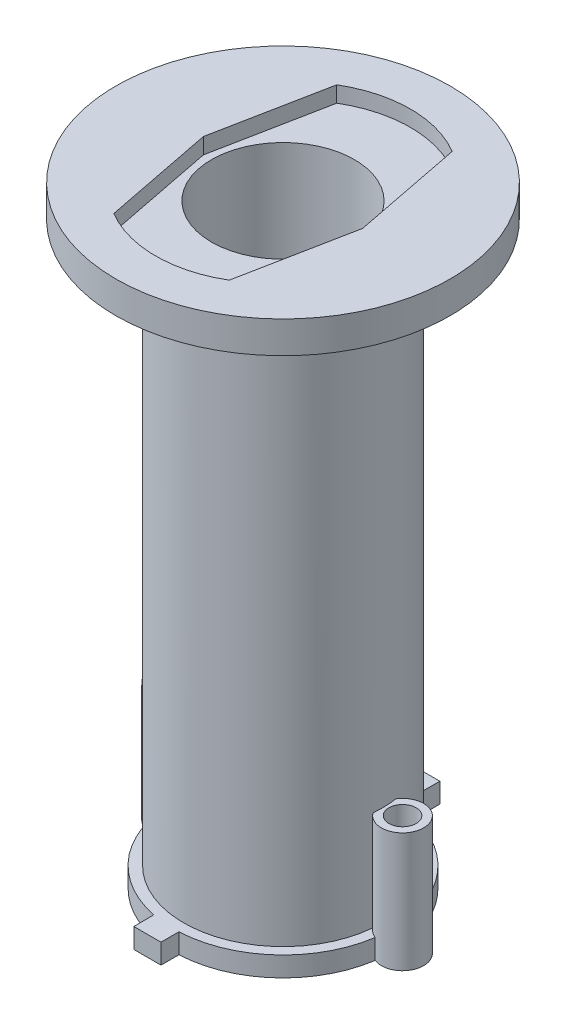
from build123d import *

# Parameters (mm, degrees)
BOSS_EXTRUDE1_DEPTH = 2.5
CUT_EXTRUDE1_REACH  = 26.645
SKETCH2_R           = 1.715
SKETCH2_R_2         = 8.98
SKETCH3_R           = 2.6543
BOSS_EXTRUDE2_DEPTH = 70.305
BOSS_EXTRUDE3_START = 4
SKETCH4_R           = 21
SKETCH4_R_2         = 8.98
BOSS_EXTRUDE3_DEPTH = 4
SKETCH6_R           = 21
SKETCH6_R_2         = 8.98
BOSS_EXTRUDE4_DEPTH = 2
CUT_EXTRUDE3_START  = -15
SKETCH7_R           = 1.715
CUT_EXTRUDE3_DEPTH  = 15
SKETCH8_R           = 8.98
CUT_EXTRUDE4_DEPTH  = 2
BOSS_EXTRUDE6_REACH = 82.451
SKETCH10_R          = 12.48
SKETCH10_R_2        = 8.98
SKETCH12_R          = 21
SKETCH12_R_2        = 12.48
CUT_EXTRUDE5_DEPTH  = 57.805


with BuildPart() as part:
    # Sketch1 → Boss-Extrude1 (new body)
    with BuildSketch(Plane(origin=(0, 0, 0), x_dir=(1, 0, 0), z_dir=(0, 1, 0))):
        with BuildLine():
            Line((0.597960958, 12.236443242), (0.597960958, 17.5133))
            Line((0.597960958, 17.5133), (-2.819411684, 17.5133))
            Line((-2.819411684, 17.5133), (-2.819411684, 11.976881697))
            ThreePointArc((-2.819411684, 11.976881697), (-9.752212861, 8.278991937), (-13.533031252, 1.391065316))
            ThreePointArc((-13.533031252, 1.391065316), (-17.156497956, -0.999626805), (-13.683409812, -3.603965207))
            ThreePointArc((-13.683409812, -3.603965207), (-10.042516815, -11.01106651), (-2.819411684, -15.004561697))
            Line((-2.819411684, -15.004561697), (-2.819411684, -17.5133))
            Line((-2.819411684, -17.5133), (0.597960958, -17.5133))
            Line((0.597960958, -17.5133), (0.597960958, -15.264123242))
            ThreePointArc((0.597960958, -15.264123242), (9.161591247, -11.721092084), (13.538839655, -3.55233882))
            ThreePointArc((13.538839655, -3.55233882), (17.156522938, -1.000460972), (13.393344487, 1.331534062))
            ThreePointArc((13.393344487, 1.331534062), (8.853545908, 8.96396608), (0.597960958, 12.236443242))
        make_face()
    extrude(amount=BOSS_EXTRUDE1_DEPTH)

    # Sketch2 → Cut-Extrude1 (cut, up to next)
    with BuildSketch(Plane(origin=(0, 2.5, 0), x_dir=(1, 0, 0), z_dir=(0, 1, 0)), mode=Mode.PRIVATE) as cut_extrude1_sk1:
        with Locations(Location((-14.5034, -1.0795, 0), (0, 0, 270))):
            Circle(SKETCH2_R)
    cut_extrude1_tool1 = extrude(cut_extrude1_sk1.sketch, amount=-CUT_EXTRUDE1_REACH, mode=Mode.PRIVATE) & part.part
    # Sketch2 → Cut-Extrude1 (cut, up to next)
    with BuildSketch(Plane(origin=(0, 2.5, 0), x_dir=(1, 0, 0), z_dir=(0, 1, 0)), mode=Mode.PRIVATE) as cut_extrude1_sk2:
        with Locations(Location((14.5034, -1.0795, 0), (0, 0, 270))):
            Circle(SKETCH2_R)
    cut_extrude1_tool2 = extrude(cut_extrude1_sk2.sketch, amount=-CUT_EXTRUDE1_REACH, mode=Mode.PRIVATE) & part.part
    # Sketch2 → Cut-Extrude1 (cut, up to next)
    with BuildSketch(Plane(origin=(0, 2.5, 0), x_dir=(1, 0, 0), z_dir=(0, 1, 0)), mode=Mode.PRIVATE) as cut_extrude1_sk3:
        with Locations(Location((-0.0762, -1.51384, 0), (0, 0, 270))):
            Circle(SKETCH2_R_2)
    cut_extrude1_tool3 = extrude(cut_extrude1_sk3.sketch, amount=-CUT_EXTRUDE1_REACH, mode=Mode.PRIVATE) & part.part
    add(cut_extrude1_tool1.solids().sort_by_distance((-14.5034, 2.5, 1.0795))[0], mode=Mode.SUBTRACT)
    add(cut_extrude1_tool2.solids().sort_by_distance((14.5034, 2.5, 1.0795))[0], mode=Mode.SUBTRACT)
    add(cut_extrude1_tool3.solids().sort_by_distance((-0.0762, 2.5, 1.51384))[0], mode=Mode.SUBTRACT)

    # Sketch3 → Boss-Extrude2 (add)
    with BuildSketch(Plane(origin=(0, 2.5, 0), x_dir=(1, 0, 0), z_dir=(0, 1, 0))):
        with Locations(Location((-14.5034, -1.0795, 0), (0, 0, 68.556492541))):
            Circle(SKETCH3_R)
        with Locations(Location((14.5034, -1.0795, 0), (0, 0, 114.72164566))):
            Circle(SKETCH3_R)
    extrude(amount=BOSS_EXTRUDE2_DEPTH)

    # Sketch4 → Boss-Extrude3 (add)
    with BuildSketch(Plane(origin=(0, 72.805, 0), x_dir=(1, 0, 0), z_dir=(0, 1, 0)).offset(BOSS_EXTRUDE3_START)):
        with Locations(Location((-0.0762, -1.51384, 0), (0, 0, 270))):
            Circle(SKETCH4_R)
        with Locations(Location((-0.0762, -1.51384, 0), (0, 0, 270))):
            Circle(SKETCH4_R_2, mode=Mode.SUBTRACT)
    extrude(amount=-BOSS_EXTRUDE3_DEPTH)

    # Sketch6 → Boss-Extrude4 (add)
    with BuildSketch(Plane(origin=(0, 37.805, 0), x_dir=(-1, 0, 0), z_dir=(0, -1, 0))):
        with Locations(Location((0.0762, -1.51384, 0), (0, 0, 90))):
            Circle(SKETCH6_R)
        with Locations(Location((0.0762, -1.51384, 0), (0, 0, 270))):
            Circle(SKETCH6_R_2, mode=Mode.SUBTRACT)
    extrude(amount=BOSS_EXTRUDE4_DEPTH)

    # Sketch7 → Cut-Extrude3 (cut)
    with BuildSketch(Plane.XZ.offset(CUT_EXTRUDE3_START)):
        with Locations(Location((-14.5034, 1.0795, 0), (0, 0, 90))):
            Circle(SKETCH7_R)
        with Locations(Location((14.5034, 1.0795, 0), (0, 0, 90))):
            Circle(SKETCH7_R)
    extrude(amount=CUT_EXTRUDE3_DEPTH, mode=Mode.SUBTRACT)

    # Sketch8 → Cut-Extrude4 (cut)
    with BuildSketch(Plane(origin=(0, 76.805, 0), x_dir=(1, 0, 0), z_dir=(0, 1, 0))):
        with BuildLine():
            Line((-10.0762, -1.51384), (-7.3262, -15.51384))
            ThreePointArc((-7.3262, -15.51384), (-0.0762, -17.51384), (7.1738, -15.51384))
            Line((7.1738, -15.51384), (9.9238, -1.51384))
            Line((9.9238, -1.51384), (7.1738, 12.48616))
            ThreePointArc((7.1738, 12.48616), (-0.0762, 14.48616), (-7.3262, 12.48616))
            Line((-7.3262, 12.48616), (-10.0762, -1.51384))
        make_face()
        with Locations(Location((-0.0762, -1.51384, 0), (0, 0, 270))):
            Circle(SKETCH8_R, mode=Mode.SUBTRACT)
    extrude(amount=-CUT_EXTRUDE4_DEPTH, mode=Mode.SUBTRACT)

    # Boss-Extrude6: up to this face of the body (flat: up to its plane)
    boss_extrude6_end = Plane(part.part.faces().sort_by_distance((-0.0762, 72.805, -18.892190304))[0])
    # Sketch10 → Boss-Extrude6 (add, up to the picked face)
    with BuildSketch(Plane(origin=(0, 2.5, 0), x_dir=(1, 0, 0), z_dir=(0, 1, 0)), mode=Mode.PRIVATE) as boss_extrude6_sk1:
        with Locations((-0.0762, -1.51384)):
            Circle(SKETCH10_R)
        with Locations(Location((-0.0762, -1.51384, 0), (0, 0, 270))):
            Circle(SKETCH10_R_2, mode=Mode.SUBTRACT)
    boss_extrude6_tool1 = split(extrude(boss_extrude6_sk1.sketch, amount=BOSS_EXTRUDE6_REACH, mode=Mode.PRIVATE), bisect_by=boss_extrude6_end, keep=Keep.BOTH, mode=Mode.PRIVATE)
    add(boss_extrude6_tool1.solids().sort_by(Axis((-12.203212, 2.5, 1.51384), (0, 1, 0)))[0])

    # Sketch12 → Cut-Extrude5 (cut)
    with BuildSketch(Plane.XZ.offset(-15)):
        with Locations(Location((-0.0762, 1.51384, 0), (0, 0, 90))):
            Circle(SKETCH12_R)
        with Locations(Location((-0.0762, 1.51384, 0), (0, 0, 189.400360909))):
            Circle(SKETCH12_R_2, mode=Mode.SUBTRACT)
    extrude(amount=-CUT_EXTRUDE5_DEPTH, mode=Mode.SUBTRACT)


solid = part.part
